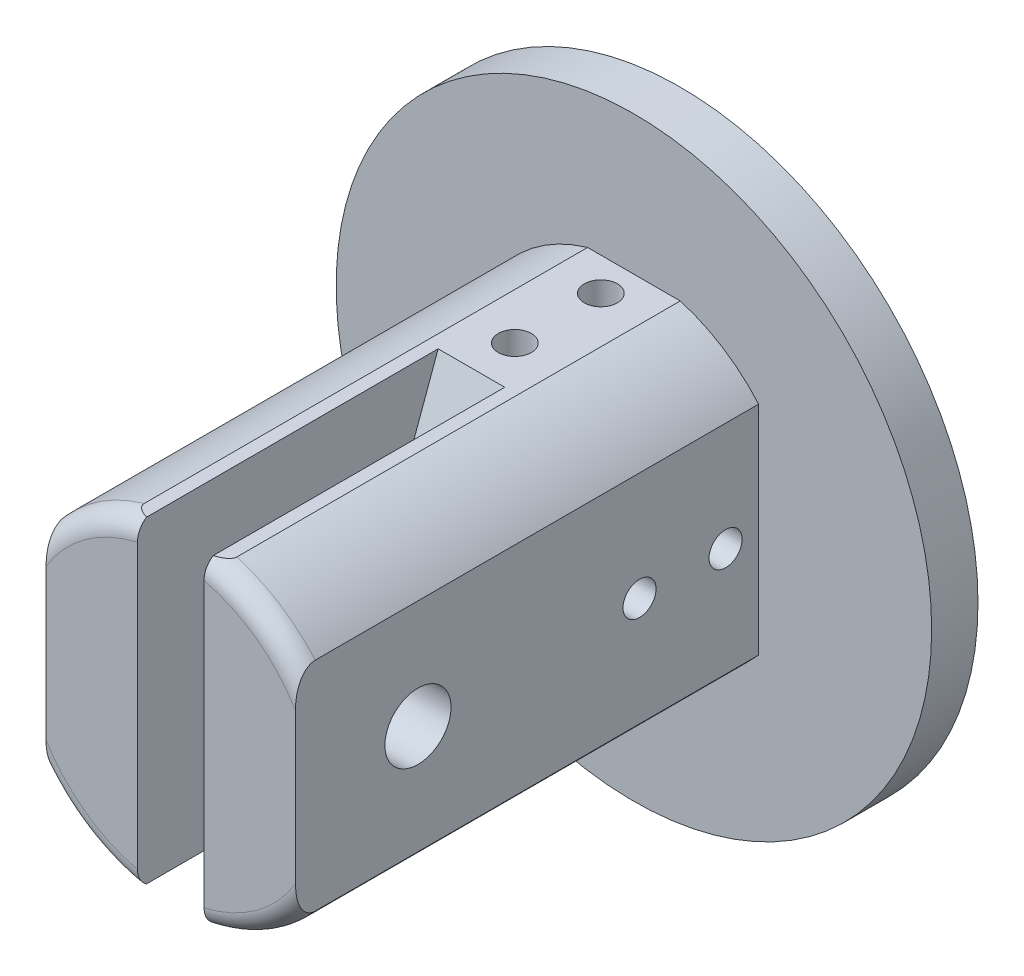
from build123d import *

# Parameters (mm, degrees)
SKETCH_1_R          = 45
EXTRUDE_1_DEPTH     = 7
SKETCH_2_R          = 25
EXTRUDE_2_DEPTH     = 70
FILLET_1_R          = 3
SKETCH_3_R          = 2.5
CUT_EXTRUDE_3_DEPTH = 35
SKETCH_5_R          = 2.5
CUT_EXTRUDE_4_DEPTH = 35
SKETCH_6_R          = 12.5
CUT_EXTRUDE_5_DEPTH = 36
SKETCH_7_W          = 10.064755008
SKETCH_7_H          = 68.890859038
SKETCH_7_W_2        = 9.000001362
SKETCH_7_H_2        = 72.567998157
CUT_EXTRUDE_6_DEPTH = 35
SKETCH_9_W          = 74.471064375
SKETCH_9_H          = 8.374114708
CUT_EXTRUDE_8_DEPTH = 35
SKETCH_10_R         = 5
CUT_EXTRUDE_1_DEPTH = 110.684759554
CHAMFER_1_SIZE      = 8
CHAMFER_1_SIZE2     = 21.979819356


with BuildPart() as part:
    # Эскиз1 → Вытянуть1 (new body)
    with BuildSketch(Plane.XY):
        Circle(SKETCH_1_R)
    extrude(amount=EXTRUDE_1_DEPTH)

    # Эскиз2 → Вытянуть2 (add)
    with BuildSketch(Plane.XY.offset(7)):
        Circle(SKETCH_2_R)
    extrude(amount=EXTRUDE_2_DEPTH)

    # Скругление1
    fillet_1_edges = [part.edges().sort_by_distance(p)[0] for p in [
        (-25, 0, 77),
    ]]
    fillet(fillet_1_edges, radius=FILLET_1_R)

    # Эскиз3 → Вытянуть3 (cut, symmetric)
    with BuildSketch(Plane(origin=(0, 0, 0), x_dir=(1, 0, 0), z_dir=(0, 1, 0))):
        with Locations(Location((0, -12, 0), (0, 0, 270))):
            Circle(SKETCH_3_R)
        with Locations(Location((0, -25, 0), (0, 0, 270))):
            Circle(SKETCH_3_R)
    extrude(amount=CUT_EXTRUDE_3_DEPTH, both=True, mode=Mode.SUBTRACT)

    # Эскиз5 → Вытянуть4 (cut, symmetric)
    with BuildSketch(Plane(origin=(0, 0, 0), x_dir=(0, 0, -1), z_dir=(1, 0, 0))):
        with Locations((-12, 0)):
            Circle(SKETCH_5_R)
        with Locations((-25, 0)):
            Circle(SKETCH_5_R)
    extrude(amount=CUT_EXTRUDE_4_DEPTH, both=True, mode=Mode.SUBTRACT)

    # Эскиз6 → Вытянуть5 (cut)
    with BuildSketch(Plane(origin=(0, 0, 0), x_dir=(-1, 0, 0), z_dir=(0, 0, -1))):
        Circle(SKETCH_6_R)
    extrude(amount=-CUT_EXTRUDE_5_DEPTH, mode=Mode.SUBTRACT)

    # Эскиз7 → Вытянуть6 (cut, symmetric)
    with BuildSketch(Plane(origin=(0, 0, 0), x_dir=(1, 0, 0), z_dir=(0, 1, 0))):
        with Locations((0, -74)):
            Rectangle(SKETCH_7_W, SKETCH_7_H)
        with Locations((23.349405244, -43.283999079)):
            Rectangle(SKETCH_7_W_2, SKETCH_7_H_2)
        with Locations((-23.349405244, -43.283999079)):
            Rectangle(SKETCH_7_W_2, SKETCH_7_H_2)
    extrude(amount=CUT_EXTRUDE_6_DEPTH, both=True, mode=Mode.SUBTRACT)

    # Эскиз9 → Вытянуть8 (cut, symmetric)
    with BuildSketch(Plane(origin=(0, 0, 0), x_dir=(0, 0, -1), z_dir=(1, 0, 0))):
        with Locations((-44.235532188, 28.187057354)):
            Rectangle(SKETCH_9_W, SKETCH_9_H)
        with Locations((-44.235532188, -28.187057354)):
            Rectangle(SKETCH_9_W, SKETCH_9_H)
    extrude(amount=CUT_EXTRUDE_8_DEPTH, both=True, mode=Mode.SUBTRACT)

    # Эскиз10 → Вырез-Вытянуть1 (cut, through all)
    with BuildSketch(Plane.ZY.offset(18.849404563)):
        with Locations((58.486255415, 0)):
            Circle(SKETCH_10_R)
    extrude(amount=-CUT_EXTRUDE_1_DEPTH, mode=Mode.SUBTRACT)

    # Фаска1
    chamfer_1_edges = [part.edges().sort_by_distance(p)[0] for p in [
        (0, 24, 39.554570481),
    ]]
    chamfer_1_side = [part.faces().sort_by_distance(p)[0] for p in [
        (0, 24, 32.18588004),
    ]]
    chamfer(chamfer_1_edges, length=CHAMFER_1_SIZE, length2=CHAMFER_1_SIZE2, reference=chamfer_1_side[0])


solid = part.part
